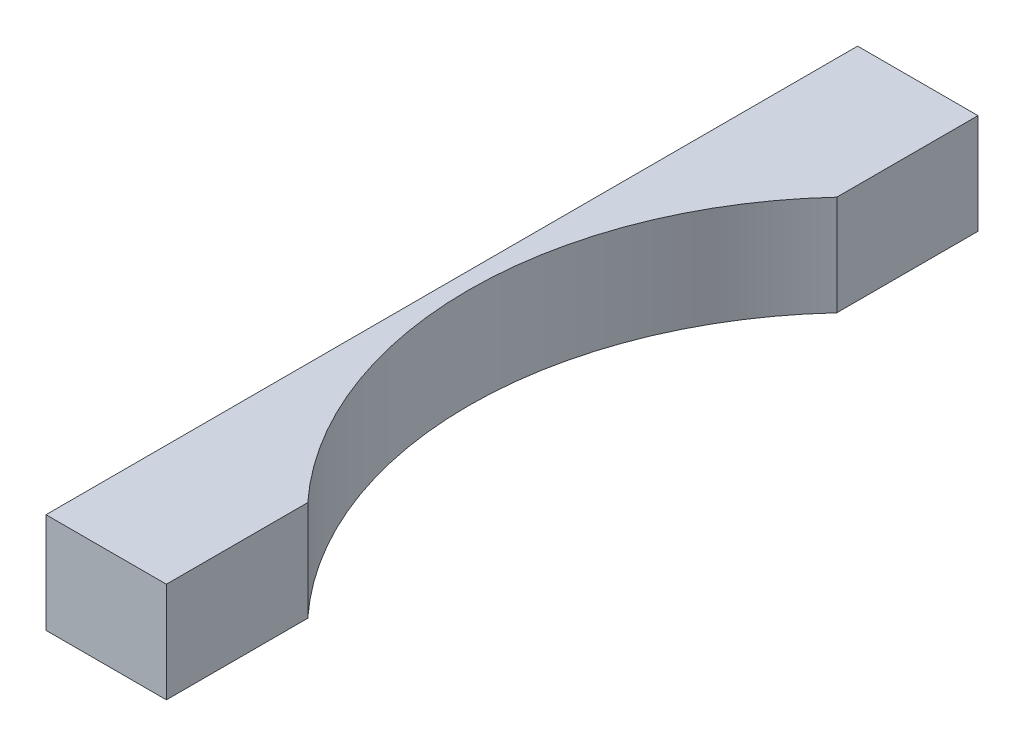
from build123d import *

# Parameters (mm, degrees)
SKETCH1_W           = 24.21
SKETCH1_H           = 6
BOSS_EXTRUDE1_DEPTH = 48.61
CUT_EXTRUDE1_DEPTH  = 53.417790043


with BuildPart() as part:
    # Sketch1 → Boss-Extrude1 (new body)
    with BuildSketch(Plane.XY):
        with Locations((-6.568312856, 6.986625)):
            Rectangle(SKETCH1_W, SKETCH1_H)
    extrude(amount=BOSS_EXTRUDE1_DEPTH)

    # Sketch3 → Cut-Extrude1 (cut, through all)
    with BuildSketch(Plane(origin=(0, 9.986625, 0), x_dir=(1, 0, 0), z_dir=(0, 1, 0))):
        with BuildLine():
            Line((-11.463312856, 0), (-11.463312856, -8.458721642))
            ThreePointArc((-11.463312856, -8.458721642), (-17.673312856, -24.3), (-11.463312856, -40.141278358))
            Line((-11.463312856, -40.141278358), (-11.463312856, -48.61))
            Line((-11.463312856, -48.61), (5.536687144, -48.61))
            Line((5.536687144, -48.61), (5.536687144, 0))
            Line((5.536687144, 0), (-11.463312856, 0))
        make_face()
    extrude(amount=-CUT_EXTRUDE1_DEPTH, mode=Mode.SUBTRACT)


solid = part.part
